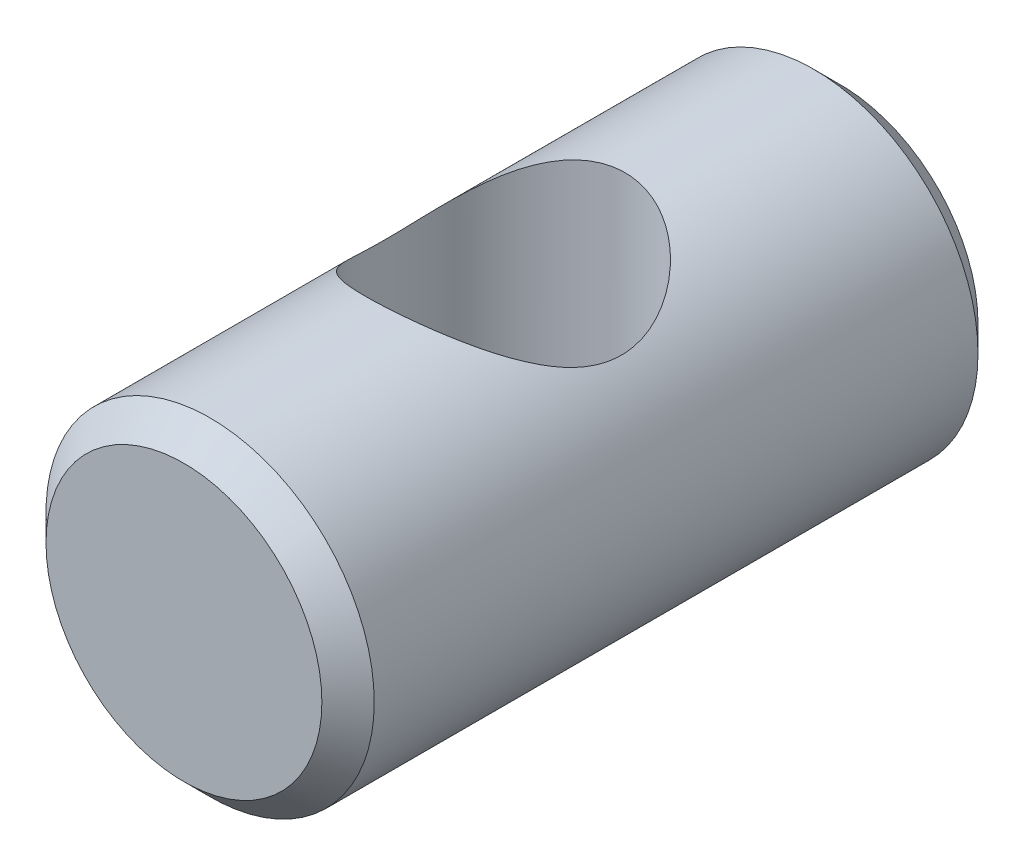
from build123d import *

# Parameters (mm, degrees)
SKETCH1_R           = 4.765
BOSS_EXTRUDE1_DEPTH = 9.525
CHAMFER1_SIZE       = 0.76
SKETCH2_R           = 3.43
CUT_EXTRUDE1_DEPTH  = 9.525


with BuildPart() as part:
    # Sketch1 → Boss-Extrude1 (new, symmetric)
    with BuildSketch(Plane.XY):
        with Locations(Location((0, 0, 0), (0, 0, 180))):
            Circle(SKETCH1_R)
    extrude(amount=BOSS_EXTRUDE1_DEPTH, both=True)

    # Chamfer1
    chamfer1_edges = [part.edges().sort_by_distance(p)[0] for p in [
        (4.765, 0, -9.525),
        (4.765, 0, 9.525),
    ]]
    chamfer(chamfer1_edges, length=CHAMFER1_SIZE)

    # Sketch2 → Cut-Extrude1 (cut, symmetric)
    with BuildSketch(Plane(origin=(0, 0, 0), x_dir=(1, 0, 0), z_dir=(0, 1, 0))):
        with Locations(Location((-0.25, 0, 0), (0, 0, 270))):
            Circle(SKETCH2_R)
    extrude(amount=CUT_EXTRUDE1_DEPTH, both=True, mode=Mode.SUBTRACT)


solid = part.part
